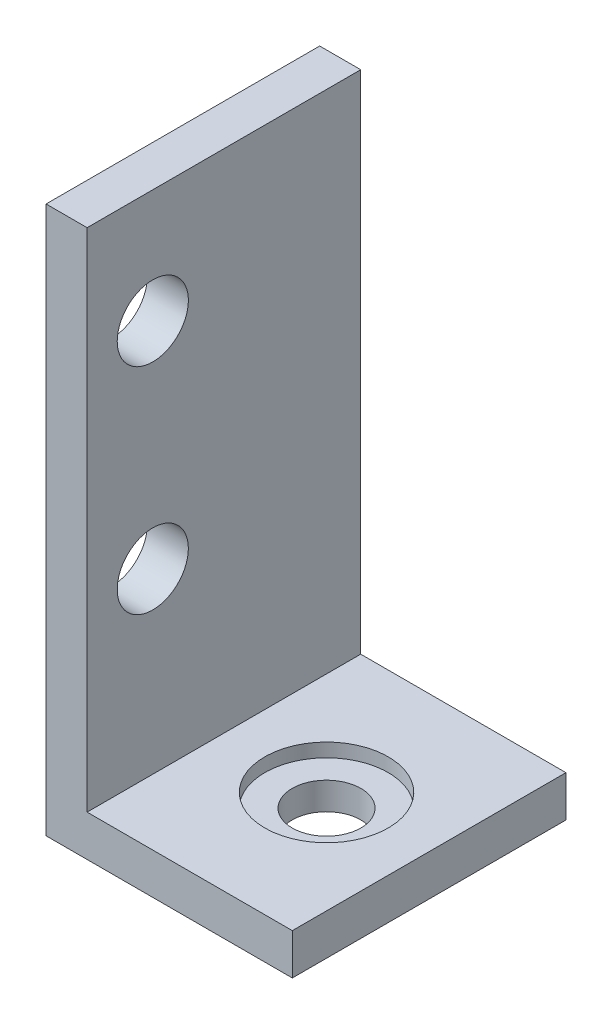
from build123d import *

# Parameters (mm, degrees)
SKETCH1_W                = 15
SKETCH1_H                = 20
SKETCH1_R                = 2.51
BOSS_EXTRUDE1_DEPTH      = 3
SKETCH2_R                = 4.51
CUT_EXTRUDE1_DEPTH       = 1
BOSS_EXTRUDE2_DEPTH      = 22
BOSS_EXTRUDE2_DEPTH_BACK = 3
SKETCH3_W                = 3
SKETCH3_H                = 20
SKETCH4_R                = 2.6
CUT_EXTRUDE2_DEPTH       = 22
BOSS_EXTRUDE3_START      = -3
SKETCH5_R                = 2.6
BOSS_EXTRUDE3_DEPTH      = 3
CUT_EXTRUDE3_DEPTH       = 5
SKETCH7_W                = 20
SKETCH7_H                = 20
BOSS_EXTRUDE4_DEPTH      = 3
SKETCH8_R                = 2.6
CUT_EXTRUDE6_DEPTH       = 3
SKETCH11_R               = 2.6
BOSS_EXTRUDE6_DEPTH      = 3
SKETCH12_R               = 2.6
CUT_EXTRUDE7_DEPTH       = 3
BOSS_EXTRUDE5_START      = 3
SKETCH9_R                = 2.6
BOSS_EXTRUDE5_DEPTH      = 3


with BuildPart() as part:
    # Sketch1 → Boss-Extrude1 (new body)
    with BuildSketch(Plane(origin=(0, 0, 0), x_dir=(1, 0, 0), z_dir=(0, 1, 0))):
        with Locations((23.125880705, 19.115097078)):
            Rectangle(SKETCH1_W, SKETCH1_H)
        with Locations(Location((23.125880705, 19.115097078, 0), (0, 0, 270))):
            Circle(SKETCH1_R, mode=Mode.SUBTRACT)
    extrude(amount=BOSS_EXTRUDE1_DEPTH)

    # Sketch2 → Cut-Extrude1 (cut)
    with BuildSketch(Plane(origin=(0, 3, 0), x_dir=(1, 0, 0), z_dir=(0, 1, 0))):
        with Locations(Location((23.125880705, 19.115097078, 0), (0, 0, 270))):
            Circle(SKETCH2_R)
    extrude(amount=-CUT_EXTRUDE1_DEPTH, mode=Mode.SUBTRACT)

    # Sketch3 → Boss-Extrude2 (add, two sides: drawn at the far end of the back side and taken through both)
    with BuildSketch(Plane(origin=(0, 3, 0), x_dir=(1, 0, 0), z_dir=(0, 1, 0)).offset(-BOSS_EXTRUDE2_DEPTH_BACK)):
        with Locations((14.125880705, 19.115097078)):
            Rectangle(SKETCH3_W, SKETCH3_H)
    extrude(amount=BOSS_EXTRUDE2_DEPTH + BOSS_EXTRUDE2_DEPTH_BACK)

    # Sketch4 → Cut-Extrude2 (cut)
    with BuildSketch(Plane.ZY.offset(-12.625880705)):
        with Locations((-23.115097078, 19)):
            Circle(SKETCH4_R)
        with Locations((-23.115097078, 6)):
            Circle(SKETCH4_R)
    extrude(amount=-CUT_EXTRUDE2_DEPTH, mode=Mode.SUBTRACT)

    # Sketch5 → Boss-Extrude3 (add)
    with BuildSketch(Plane(origin=(15.625880705, 0, 0), x_dir=(0, 0, -1), z_dir=(1, 0, 0)).offset(BOSS_EXTRUDE3_START)):
        with Locations((23.115097078, 19)):
            Circle(SKETCH5_R)
        with Locations((23.115097078, 6)):
            Circle(SKETCH5_R)
    extrude(amount=BOSS_EXTRUDE3_DEPTH)

    # Sketch6 → Cut-Extrude3 (cut)
    with BuildSketch(Plane(origin=(12.625880705, 25, -29.115097078), x_dir=(1, 0, 0), z_dir=(0, 1, 0))):
        Polygon((0, -14.855128206), (0, -20), (3, -20), (3, -14.855128206), (3, 0), (0, 0), align=None)
    extrude(amount=-CUT_EXTRUDE3_DEPTH, mode=Mode.SUBTRACT)

    # Sketch7 → Boss-Extrude4 (add)
    with BuildSketch(Plane.ZY.offset(-12.625880705)):
        with Locations((-19.115097078, 30)):
            Rectangle(SKETCH7_W, SKETCH7_H)
    extrude(amount=-BOSS_EXTRUDE4_DEPTH)

    # Sketch8 → Cut-Extrude6 (cut)
    with BuildSketch(Plane(origin=(15.625880705, 0, 0), x_dir=(0, 0, -1), z_dir=(1, 0, 0))):
        with Locations((13.915097078, 16)):
            Circle(SKETCH8_R)
        with Locations((13.915097078, 26.1)):
            Circle(SKETCH8_R)
    extrude(amount=-CUT_EXTRUDE6_DEPTH, mode=Mode.SUBTRACT)

    # Sketch11 → Boss-Extrude6 (add)
    with BuildSketch(Plane(origin=(15.625880705, 0, 0), x_dir=(0, 0, -1), z_dir=(1, 0, 0))):
        with Locations((13.915097078, 26.1)):
            Circle(SKETCH11_R)
    extrude(amount=-BOSS_EXTRUDE6_DEPTH)

    # Sketch12 → Cut-Extrude7 (cut)
    with BuildSketch(Plane.ZY.offset(-12.625880705)):
        with Locations((-13.915097078, 31.7)):
            Circle(SKETCH12_R)
    extrude(amount=-CUT_EXTRUDE7_DEPTH, mode=Mode.SUBTRACT)

    # Sketch9 → Boss-Extrude5 (add)
    with BuildSketch(Plane(origin=(15.625880705, 0, 0), x_dir=(0, 0, -1), z_dir=(1, 0, 0)).offset(BOSS_EXTRUDE5_START)):
        with Locations((13.915097078, 16)):
            Circle(SKETCH9_R)
    extrude(amount=-BOSS_EXTRUDE5_DEPTH)


with BuildPart() as boss_extrude5_kept_piece:
    # of the separate pieces the step leaves, the one the design keeps (boss_extrude5_pieces_kept)
    add(part.part.solids().sort_by_distance((12.625880705, 0, -9.115097078))[0])


solid = boss_extrude5_kept_piece.part
